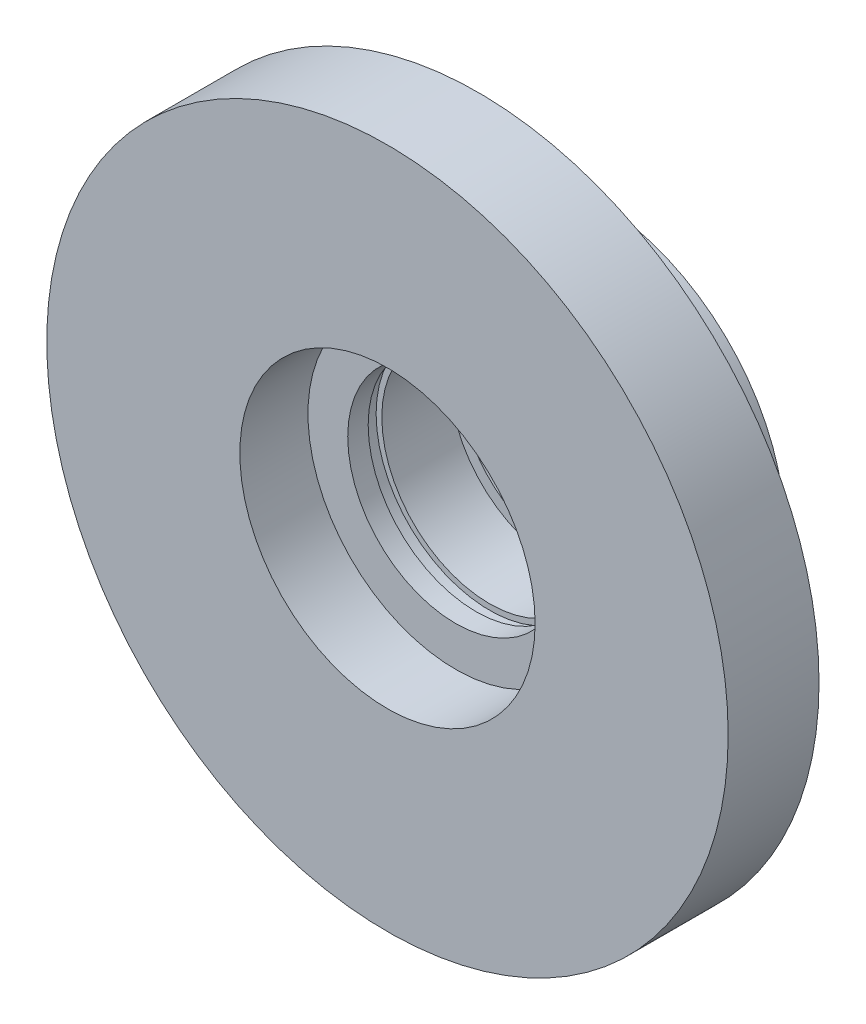
from build123d import *

# Parameters (mm, degrees)
SKETCH1_R           = 17
SKETCH1_R_2         = 13
BOSS_EXTRUDE1_DEPTH = 10
SKETCH2_R           = 30
SKETCH2_R_2         = 13
BOSS_EXTRUDE2_DEPTH = 8
SKETCH6_R           = 17
SKETCH6_R_2         = 8.5
BOSS_EXTRUDE3_DEPTH = 3
SKETCH7_R           = 13
SKETCH7_R_2         = 9.5
BOSS_EXTRUDE4_DEPTH = 9
CUT_EXTRUDE2_START  = -1.8
SKETCH8_R           = 10
CUT_EXTRUDE2_DEPTH  = 1.2


with BuildPart() as part:
    # Sketch1 → Boss-Extrude1 (new body)
    with BuildSketch(Plane.XY):
        Circle(SKETCH1_R)
        Circle(SKETCH1_R_2, mode=Mode.SUBTRACT)
    extrude(amount=BOSS_EXTRUDE1_DEPTH)

    # Sketch2 → Boss-Extrude2 (add)
    with BuildSketch(Plane.XY.offset(10)):
        Circle(SKETCH2_R)
        Circle(SKETCH2_R_2, mode=Mode.SUBTRACT)
    extrude(amount=BOSS_EXTRUDE2_DEPTH)

    # Sketch6 → Boss-Extrude3 (add)
    with BuildSketch(Plane(origin=(0, 0, 0), x_dir=(-1, 0, 0), z_dir=(0, 0, -1))):
        with Locations(Location((0, 0, 0), (0, 0, 180))):
            Circle(SKETCH6_R)
        Circle(SKETCH6_R_2, mode=Mode.SUBTRACT)
    extrude(amount=-BOSS_EXTRUDE3_DEPTH)

    # Sketch7 → Boss-Extrude4 (add)
    with BuildSketch(Plane.XY.offset(3)):
        Circle(SKETCH7_R)
        Circle(SKETCH7_R_2, mode=Mode.SUBTRACT)
    extrude(amount=BOSS_EXTRUDE4_DEPTH)

    # Sketch8 → Cut-Extrude2 (cut)
    with BuildSketch(Plane.XY.offset(12).offset(CUT_EXTRUDE2_START)):
        Circle(SKETCH8_R)
    extrude(amount=-CUT_EXTRUDE2_DEPTH, mode=Mode.SUBTRACT)


solid = part.part
